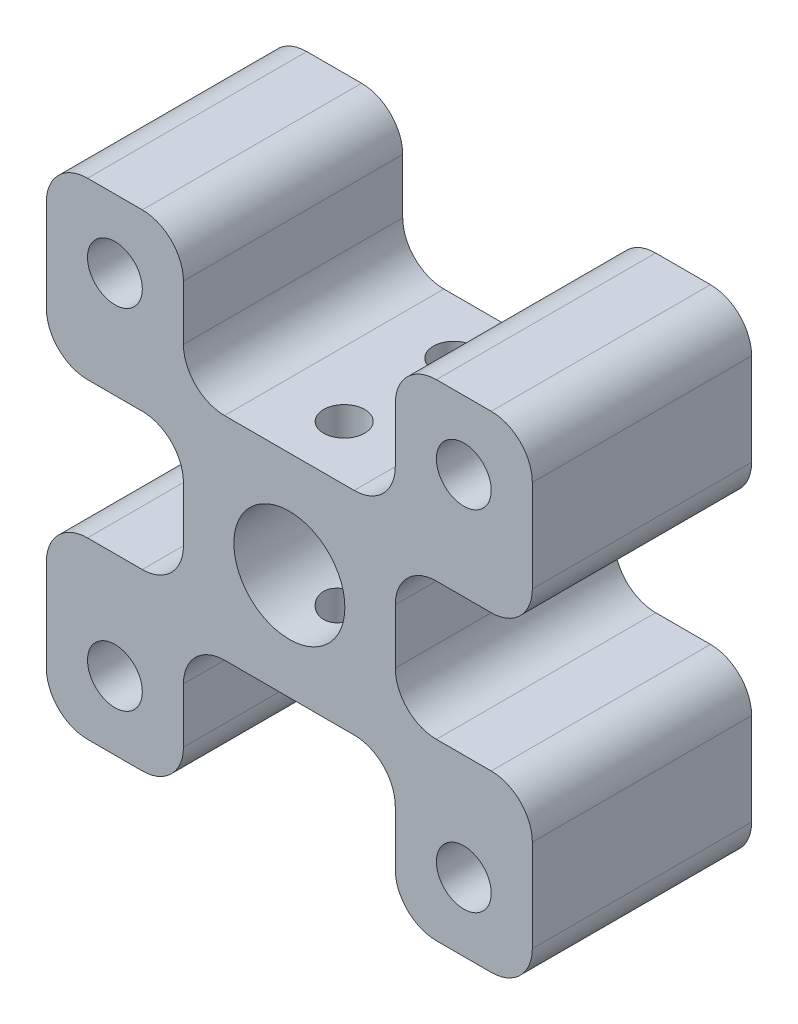
from build123d import *

# Parameters (mm, degrees)
SKETCH_1_R          = 2
SKETCH_1_R_2        = 4.05
EXTRUDE_1_DEPTH     = 16
FILLET_3_R          = 3
SKETCH_3_R          = 1.5
CUT_EXTRUDE_2_DEPTH = 35.903856816


with BuildPart() as part:
    # ｽｹｯﾁ1 → ﾎﾞｽ - 押し出し1 (new body)
    with BuildSketch(Plane.XY):
        Polygon((-7.727922061, 17.727922061), (-7.727922061, 7.727922061), (7.727922061, 7.727922061), (7.727922061, 17.727922061), (17.727922061, 17.727922061), (17.727922061, 5), (7.727922061, 5), (7.727922061, -5), (17.727922061, -5), (17.727922061, -17.727922061), (7.727922061, -17.727922061), (7.727922061, -7.727922061), (-7.727922061, -7.727922061), (-7.727922061, -17.727922061), (-17.727922061, -17.727922061), (-17.727922061, -5), (-7.727922061, -5), (-7.727922061, 5), (-17.727922061, 5), (-17.727922061, 17.727922061), align=None)
        with Locations((-12.727922061, 12.727922061)):
            Circle(SKETCH_1_R, mode=Mode.SUBTRACT)
        with Locations((12.727922061, 12.727922061)):
            Circle(SKETCH_1_R, mode=Mode.SUBTRACT)
        with Locations((12.727922061, -12.727922061)):
            Circle(SKETCH_1_R, mode=Mode.SUBTRACT)
        with Locations((-12.727922061, -12.727922061)):
            Circle(SKETCH_1_R, mode=Mode.SUBTRACT)
        Circle(SKETCH_1_R_2, mode=Mode.SUBTRACT)
    extrude(amount=EXTRUDE_1_DEPTH)

    # ﾌｨﾚｯﾄ3
    fillet_3_edges = [part.edges().sort_by_distance(p)[0] for p in [
        (-17.727922061, 17.727922061, 8),
        (-7.727922061, 17.727922061, 8),
        (-7.727922061, 7.727922061, 8),
        (7.727922061, 7.727922061, 8),
        (7.727922061, 17.727922061, 8),
        (17.727922061, 17.727922061, 8),
        (17.727922061, 5, 8),
        (7.727922061, 5, 8),
        (7.727922061, -5, 8),
        (17.727922061, -5, 8),
        (17.727922061, -17.727922061, 8),
        (7.727922061, -17.727922061, 8),
        (7.727922061, -7.727922061, 8),
        (-7.727922061, -7.727922061, 8),
        (-7.727922061, -17.727922061, 8),
        (-17.727922061, -17.727922061, 8),
        (-17.727922061, -5, 8),
        (-7.727922061, -5, 8),
        (-7.727922061, 5, 8),
        (-17.727922061, 5, 8),
    ]]
    fillet(fillet_3_edges, radius=FILLET_3_R)

    # ｽｹｯﾁ3 → ｶｯﾄ - 押し出し2 (cut, through all)
    with BuildSketch(Plane(origin=(0, 7.727922061, 0), x_dir=(1, 0, 0), z_dir=(0, 1, 0))):
        with Locations(Location((0, -4, 0), (0, 0, 270))):
            Circle(SKETCH_3_R)
        with Locations(Location((0, -12, 0), (0, 0, 270))):
            Circle(SKETCH_3_R)
    extrude(amount=-CUT_EXTRUDE_2_DEPTH, mode=Mode.SUBTRACT)


solid = part.part
